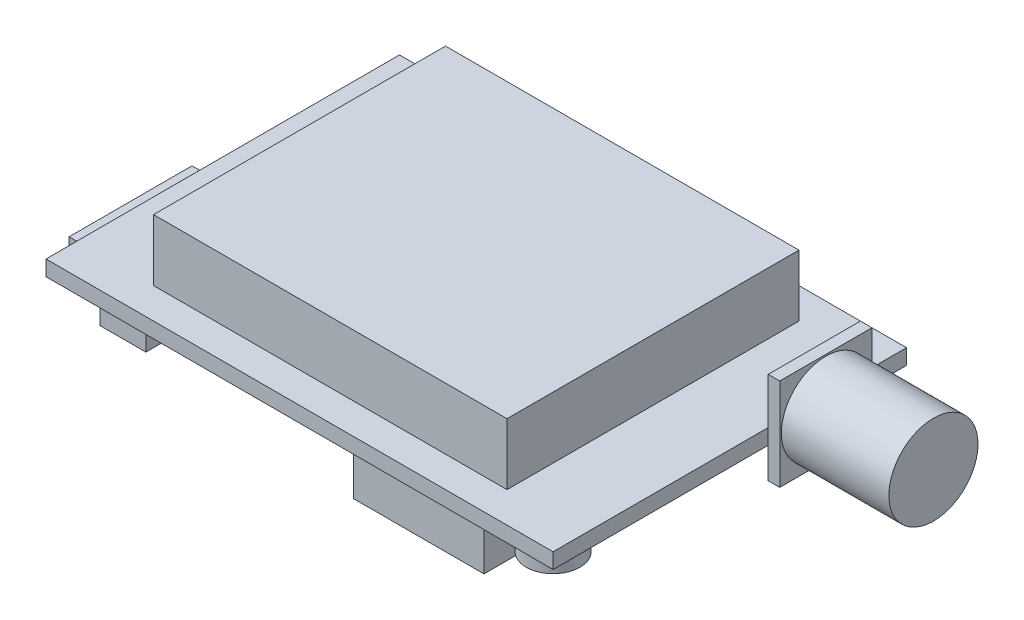
from build123d import *

# Parameters (mm, degrees)
SKETCH1_W            = 33
SKETCH1_H            = 23
BOSS_EXTRUDE1_DEPTH  = 1
SKETCH2_W            = 23
SKETCH2_H            = 19
BOSS_EXTRUDE2_DEPTH  = 4
SKETCH3_W            = 8.5
SKETCH3_H            = 7
BOSS_EXTRUDE4_DEPTH  = 3
SKETCH4_R            = 1.75
BOSS_EXTRUDE5_DEPTH  = 1
SKETCH5_W            = 6
SKETCH5_H            = 6
BOSS_EXTRUDE6_DEPTH  = 0.75
SKETCH6_R            = 2.9
BOSS_EXTRUDE7_DEPTH  = 7
SKETCH7_W            = 6
SKETCH7_H            = 3
BOSS_EXTRUDE8_DEPTH  = 1.5
SKETCH8_W            = 4
SKETCH8_H            = 1
BOSS_EXTRUDE9_DEPTH  = 1
SKETCH9_W            = 3
SKETCH9_H            = 10
BOSS_EXTRUDE10_DEPTH = 4
SKETCH10_W           = 8
SKETCH10_H           = 2
BOSS_EXTRUDE11_DEPTH = 3


with BuildPart() as part:
    # Sketch1 → Boss-Extrude1 (new body)
    with BuildSketch(Plane(origin=(0, 0, 0), x_dir=(1, 0, 0), z_dir=(0, 1, 0))):
        with Locations((-5.9, -2)):
            Rectangle(SKETCH1_W, SKETCH1_H)
    extrude(amount=BOSS_EXTRUDE1_DEPTH)

    # Sketch2 → Boss-Extrude2 (add)
    with BuildSketch(Plane(origin=(0, 1, 0), x_dir=(1, 0, 0), z_dir=(0, 1, 0))):
        with Locations((-5.9, -2)):
            Rectangle(SKETCH2_W, SKETCH2_H)
    extrude(amount=BOSS_EXTRUDE2_DEPTH)

    # Sketch3 → Boss-Extrude4 (add)
    with BuildSketch(Plane(origin=(0, 0, 0), x_dir=(-1, 0, 0), z_dir=(0, -1, 0))):
        with Locations((-1.35, -9.5)):
            Rectangle(SKETCH3_W, SKETCH3_H)
    extrude(amount=BOSS_EXTRUDE4_DEPTH)

    # Sketch4 → Boss-Extrude5 (add)
    with BuildSketch(Plane.XZ):
        with Locations(Location((8.6, 11.5, 0), (0, 0, 90))):
            Circle(SKETCH4_R)
    extrude(amount=BOSS_EXTRUDE5_DEPTH)

    # Sketch5 → Boss-Extrude6 (add)
    with BuildSketch(Plane(origin=(10.6, 0, 0), x_dir=(0, 0, -1), z_dir=(1, 0, 0))):
        with Locations((3.5, 1)):
            Rectangle(SKETCH5_W, SKETCH5_H)
    extrude(amount=BOSS_EXTRUDE6_DEPTH)

    # Sketch6 → Boss-Extrude7 (add)
    with BuildSketch(Plane(origin=(11.35, 0, 0), x_dir=(0, 0, -1), z_dir=(1, 0, 0))):
        with Locations((3.5, 1)):
            Circle(SKETCH6_R)
    extrude(amount=BOSS_EXTRUDE7_DEPTH)

    # Sketch7 → Boss-Extrude8 (add)
    with BuildSketch(Plane(origin=(0, 0, 0), x_dir=(-1, 0, 0), z_dir=(0, -1, 0))):
        with Locations((-1.6, 7.5)):
            Rectangle(SKETCH7_W, SKETCH7_H)
    extrude(amount=BOSS_EXTRUDE8_DEPTH)

    # Sketch8 → Boss-Extrude9 (add)
    with BuildSketch(Plane.XZ.offset(1.5)):
        with Locations((1.6, -7.5)):
            Rectangle(SKETCH8_W, SKETCH8_H)
    extrude(amount=BOSS_EXTRUDE9_DEPTH)

    # Sketch9 → Boss-Extrude10 (add)
    with BuildSketch(Plane.XZ):
        with Locations((-20.4, 5.5)):
            Rectangle(SKETCH9_W, SKETCH9_H)
    extrude(amount=BOSS_EXTRUDE10_DEPTH)

    # Sketch10 → Boss-Extrude11 (add)
    with BuildSketch(Plane.ZY.offset(21.9)):
        with Locations((5.5, -2)):
            Rectangle(SKETCH10_W, SKETCH10_H)
    extrude(amount=BOSS_EXTRUDE11_DEPTH)


solid = part.part
